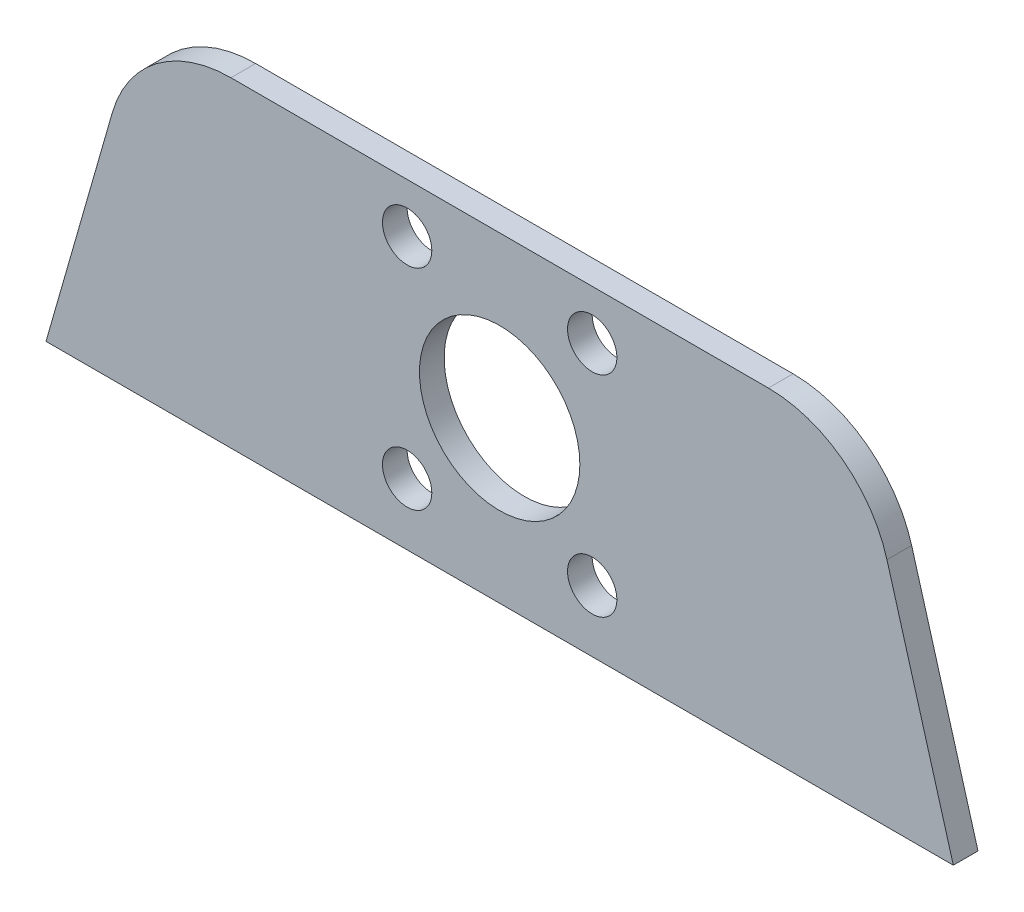
from build123d import *

# Parameters (mm, degrees)
SKETCH_1_R      = 2
SKETCH_1_R_2    = 6.5
EXTRUDE_1_DEPTH = 2
FILLET_1_R      = 10


with BuildPart() as part:
    # 草图1 → 凸台-拉伸1 (new body)
    with BuildSketch(Plane.XY):
        Polygon((-29.269334238, -5), (44.269334238, -5), (36.813954208, 21), (-21.813954208, 21), align=None)
        with Locations((15, 17)):
            Circle(SKETCH_1_R, mode=Mode.SUBTRACT)
        with Locations((15, 0)):
            Circle(SKETCH_1_R, mode=Mode.SUBTRACT)
        Circle(SKETCH_1_R, mode=Mode.SUBTRACT)
        with Locations((0, 17)):
            Circle(SKETCH_1_R, mode=Mode.SUBTRACT)
        with Locations((7.5, 8)):
            Circle(SKETCH_1_R_2, mode=Mode.SUBTRACT)
    extrude(amount=EXTRUDE_1_DEPTH)

    # 圆角1
    fillet_1_edges = [part.edges().sort_by_distance(p)[0] for p in [
        (-21.813954208, 21, 1),
        (36.813954208, 21, 1),
    ]]
    fillet(fillet_1_edges, radius=FILLET_1_R)


solid = part.part
